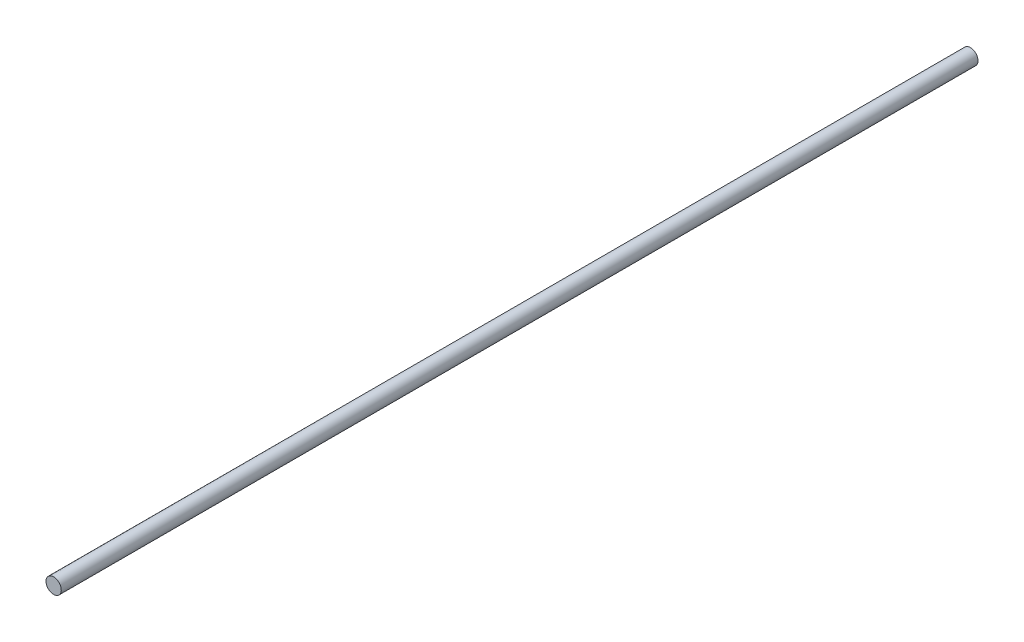
from build123d import *

# Parameters (mm, degrees)
SKETCH1_R           = 5
BOSS_EXTRUDE1_DEPTH = 600


with BuildPart() as part:
    # Sketch1 → Boss-Extrude1 (new body)
    with BuildSketch(Plane.XY):
        Circle(SKETCH1_R)
    extrude(amount=BOSS_EXTRUDE1_DEPTH)


solid = part.part
